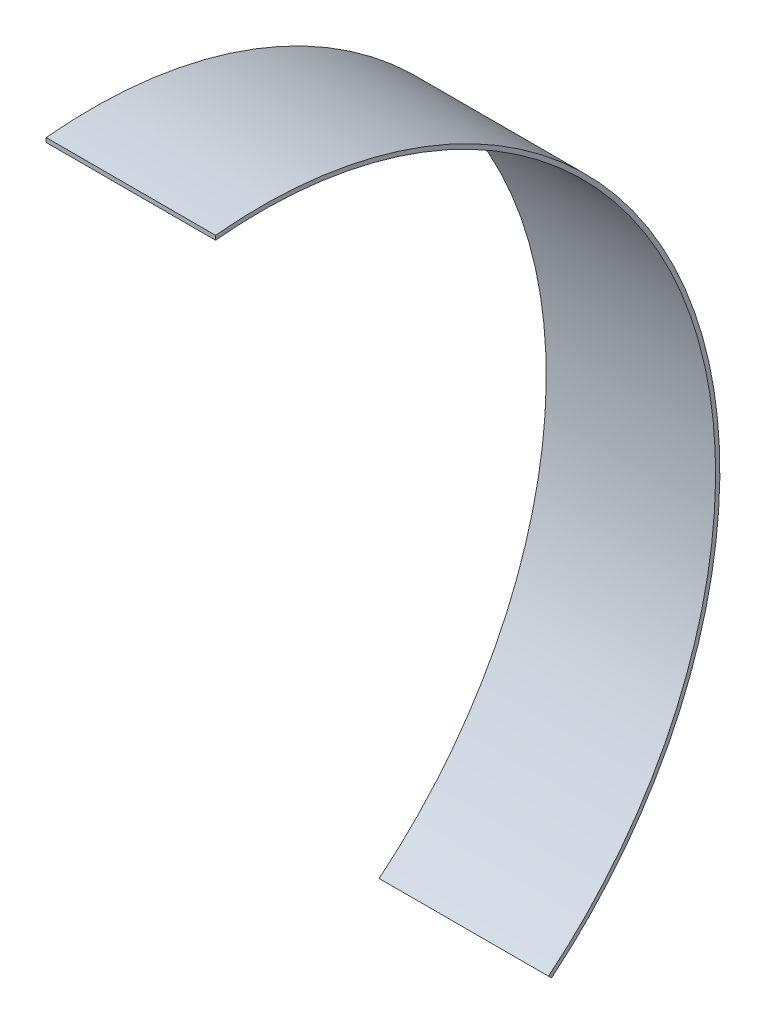
from build123d import *

# Parameters (mm, degrees)
BOSS_EXTRUDE1_DEPTH = 13.85


with BuildPart() as part:
    # Sketch1 → Boss-Extrude1 (new, symmetric)
    with BuildSketch(Plane(origin=(0, 0, 0), x_dir=(0, 0, -1), z_dir=(1, 0, 0))):
        with BuildLine():
            ThreePointArc((74.3, 0), (67.119640803, -31.866029224), (46.966384428, -57.572986146))
            Line((46.966384428, -57.572986146), (47.463876439, -58.070478157))
            ThreePointArc((47.463876439, -58.070478157), (67.76721454, -32.13416614), (75, 0))
            ThreePointArc((75, 0), (50.311529494, 55.621488653), (-7.5, 74.624057783))
            Line((-7.5, 74.624057783), (-7.5, 73.920497834))
            ThreePointArc((-7.5, 73.920497834), (49.815860928, 55.125946704), (74.3, 0))
        make_face()
    extrude(amount=BOSS_EXTRUDE1_DEPTH, both=True)


solid = part.part
